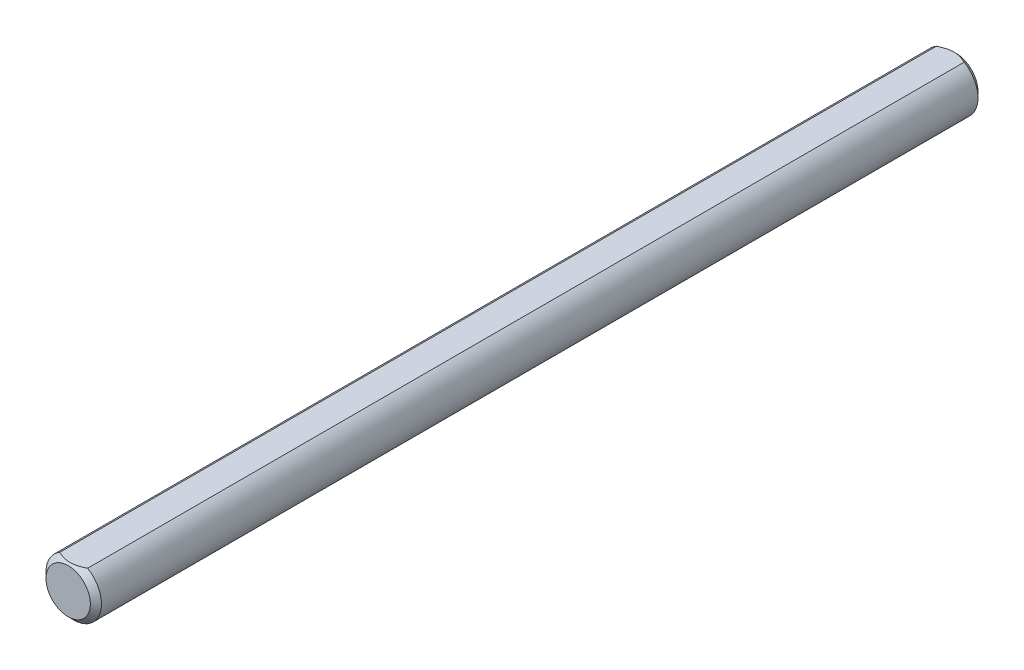
from build123d import *

# Parameters (mm, degrees)
SKETCH1_R           = 3.175
EXTRUDE1_DEPTH      = 50.8
CHAMFER1_SIZE       = 0.635
EXTRUDE7_DEPTH      = 51.998051433
EXTRUDE7_DEPTH_BACK = 51.998051433


with BuildPart() as part:
    # Sketch1 → Extrude1 (new, symmetric)
    with BuildSketch(Plane.XY):
        Circle(SKETCH1_R)
    extrude(amount=EXTRUDE1_DEPTH, both=True)

    # Chamfer1
    chamfer1_edges = [part.edges().sort_by_distance(p)[0] for p in [
        (-3.175, 0, -50.8),
        (-3.175, 0, 50.8),
    ]]
    chamfer(chamfer1_edges, length=CHAMFER1_SIZE)

    # Sketch13 → Extrude7 (cut, two sides: drawn at the far end of the back side and taken through both)
    with BuildSketch(Plane.XY.offset(-EXTRUDE7_DEPTH_BACK)):
        with BuildLine():
            Line((-1.5875, 2.749630657), (1.5875, 2.749630657))
            ThreePointArc((1.5875, 2.749630657), (0, 3.175), (-1.5875, 2.749630657))
        make_face()
    extrude(amount=EXTRUDE7_DEPTH + EXTRUDE7_DEPTH_BACK, mode=Mode.SUBTRACT)


solid = part.part
